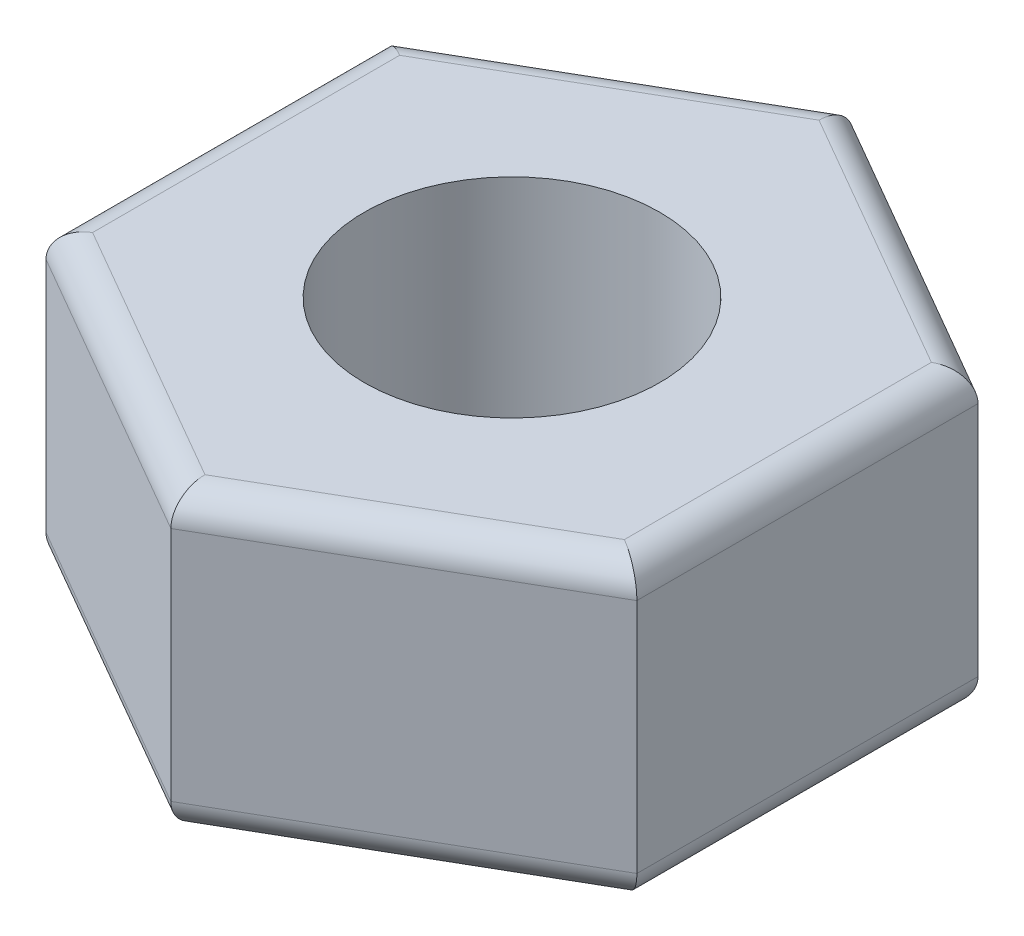
from build123d import *

# Parameters (mm, degrees)
SKETCH1_R           = 2
BOSS_EXTRUDE1_DEPTH = 4
FILLET1_R           = 0.4


with BuildPart() as part:
    # Sketch1 → Boss-Extrude1 (new body)
    with BuildSketch(Plane(origin=(0, 0, 0), x_dir=(1, 0, 0), z_dir=(0, 1, 0))):
        Polygon((0, 4.618802154), (-4, 2.309401077), (-4, -2.309401077), (0, -4.618802154), (4, -2.309401077), (4, 2.309401077), align=None)
        with Locations(Location((0, 0, 0), (0, 0, 270))):
            Circle(SKETCH1_R, mode=Mode.SUBTRACT)
    extrude(amount=BOSS_EXTRUDE1_DEPTH)

    # Fillet1
    fillet1_edges = [part.edges().sort_by_distance(p)[0] for p in [
        (-4, 4, 0),
        (-2, 4, 3.464101615),
        (2, 4, 3.464101615),
        (4, 4, 0),
        (2, 4, -3.464101615),
        (4, 0, 0),
        (2, 0, 3.464101615),
        (-2, 0, 3.464101615),
        (-4, 0, 0),
        (-2, 0, -3.464101615),
        (2, 0, -3.464101615),
        (-2, 4, -3.464101615),
    ]]
    fillet(fillet1_edges, radius=FILLET1_R)


solid = part.part
